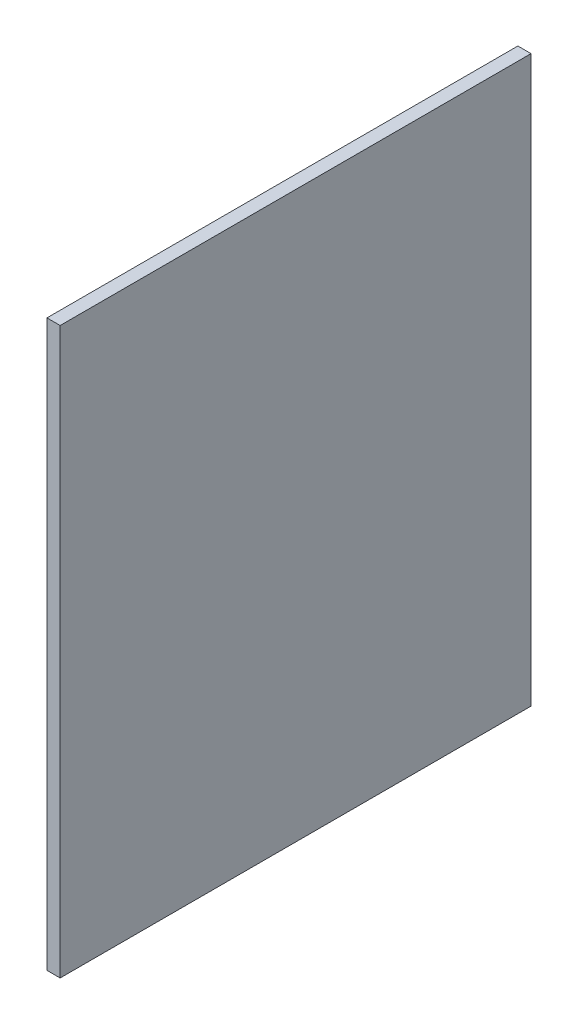
from build123d import *

# Parameters (mm, degrees)
SKETCH1_W           = 70
SKETCH1_H           = 3000
BOSS_EXTRUDE1_DEPTH = 2500


with BuildPart() as part:
    # Sketch1 → Boss-Extrude1 (new body)
    with BuildSketch(Plane.XY):
        Rectangle(SKETCH1_W, SKETCH1_H)
    extrude(amount=BOSS_EXTRUDE1_DEPTH)


solid = part.part
